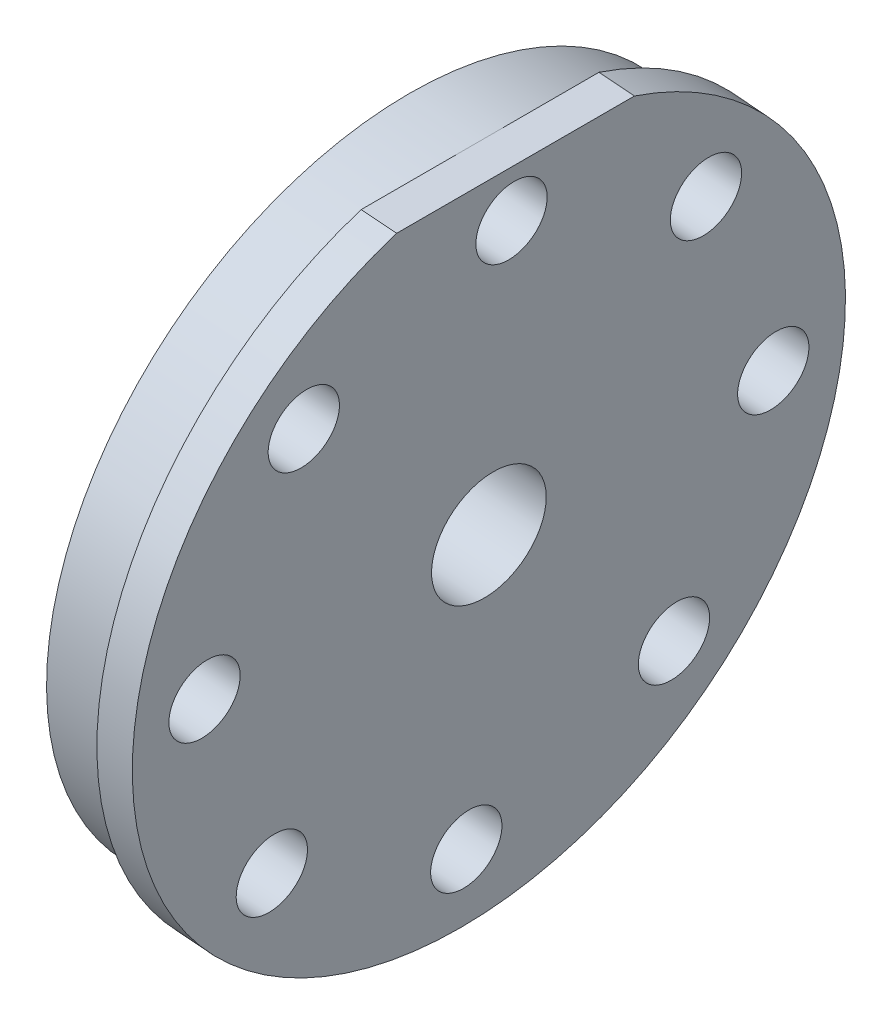
from build123d import *

# Parameters (mm, degrees)
SKETCH1_R           = 14.9606
BOSS_EXTRUDE1_DEPTH = 4.7625
SKETCH2_R           = 2.5527
CUT_EXTRUDE1_DEPTH  = 6.35
SKETCH3_R           = 1.5875
CUT_EXTRUDE2_DEPTH  = 10
SKETCH5_R           = 15.875
SKETCH5_R_2         = 14.9606
BOSS_EXTRUDE2_DEPTH = 1.5875
CUT_EXTRUDE3_DEPTH  = 2.54


with BuildPart() as part:
    # Sketch1 → Boss-Extrude1 (new body)
    with BuildSketch(Plane(origin=(234.278878836, -18.689027227, 0), x_dir=(0, 0, -1), z_dir=(0.9968332748770866, -0.0795199477981641, 0))):
        with Locations(Location((-43.174261814, 8.550344032, 0), (0, 0, 90))):
            Circle(SKETCH1_R)
    extrude(amount=-BOSS_EXTRUDE1_DEPTH)

    # Sketch2 → Cut-Extrude1 (cut)
    with BuildSketch(Plane(origin=(234.278878836, -18.689027227, 0), x_dir=(0, 0, -1), z_dir=(0.9968332748770866, -0.07951994779816411, 0))):
        with Locations(Location((-43.174261814, 8.550344032, 0), (0, 0, 90))):
            Circle(SKETCH2_R)
    extrude(amount=-CUT_EXTRUDE1_DEPTH, mode=Mode.SUBTRACT)

    # Sketch3 → Cut-Extrude2 (cut)
    with BuildSketch(Plane(origin=(229.531460364, -18.310313476, 0), x_dir=(0, 0, 1), z_dir=(-0.9968332748770866, 0.07951994779816411, 0))):
        with Locations(Location((30.474261814, 8.550344032, 0), (0, 0, 270))):
            Circle(SKETCH3_R)
        with Locations(Location((43.174261814, 21.250344032, 0), (0, 0, 270))):
            Circle(SKETCH3_R)
        with Locations(Location((52.154517935, 17.530600153, 0), (0, 0, 270))):
            Circle(SKETCH3_R)
        with Locations(Location((55.874261814, 8.550344032, 0), (0, 0, 270))):
            Circle(SKETCH3_R)
        with Locations(Location((52.154517935, -0.429912089, 0), (0, 0, 270))):
            Circle(SKETCH3_R)
        with Locations(Location((43.174261814, -4.149655968, 0), (0, 0, 270))):
            Circle(SKETCH3_R)
        with Locations(Location((34.194005693, -0.429912089, 0), (0, 0, 270))):
            Circle(SKETCH3_R)
        with Locations(Location((34.194005693, 17.530600153, 0), (0, 0, 270))):
            Circle(SKETCH3_R)
    extrude(amount=-CUT_EXTRUDE2_DEPTH, mode=Mode.SUBTRACT)

    # Sketch5 → Boss-Extrude2 (add)
    with BuildSketch(Plane(origin=(234.278878836, -18.689027227, 0), x_dir=(0, 0, 1), z_dir=(-0.9968332748770866, 0.07951994779816411, 0))):
        with Locations(Location((43.174261814, 8.550344032, 0), (0, 0, 270))):
            Circle(SKETCH5_R)
        with Locations(Location((43.174261814, 8.550344032, 0), (0, 0, 90))):
            Circle(SKETCH5_R_2, mode=Mode.SUBTRACT)
    extrude(amount=BOSS_EXTRUDE2_DEPTH)

    # Sketch6 → Cut-Extrude3 (cut)
    with BuildSketch(Plane(origin=(234.278878836, -18.689027227, 0), x_dir=(0, 0, -1), z_dir=(0.9968332748770866, -0.07951994779816411, 0))):
        Polygon((-133.921695756, 23.510944032), (-48.484259238, 23.510944032), (-37.864264391, 23.510944032), (47.573172128, 23.510944032), (47.573172128, 194.385817069), (-133.921695756, 194.385817069), align=None)
    extrude(amount=-CUT_EXTRUDE3_DEPTH, mode=Mode.SUBTRACT)


solid = part.part
